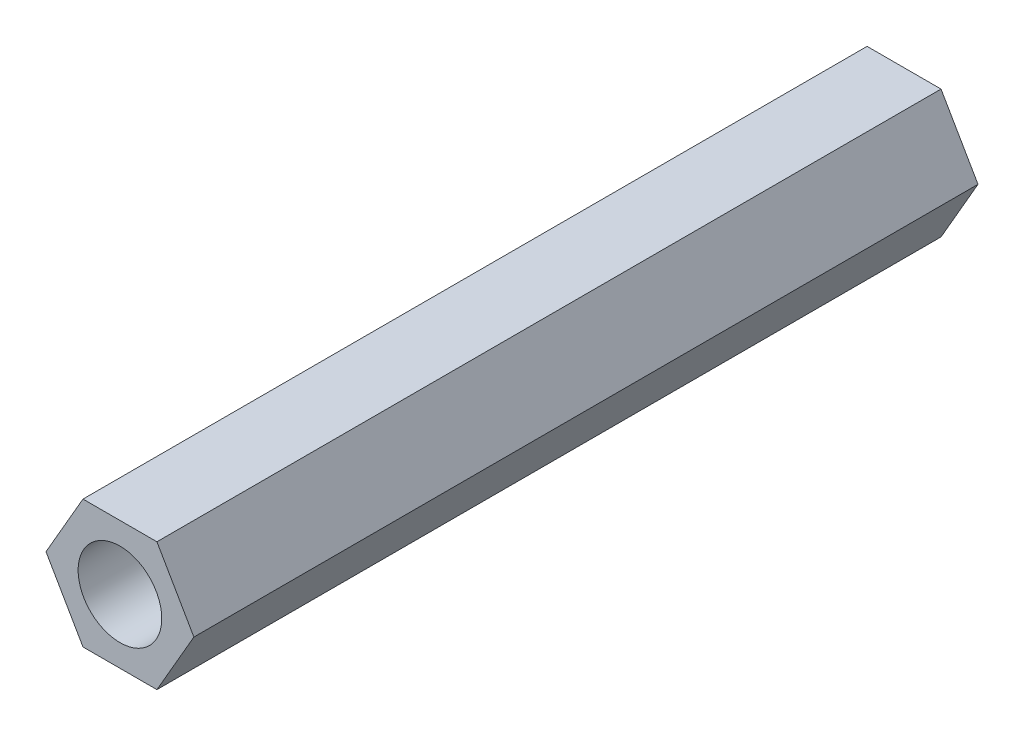
from build123d import *

# Parameters (mm, degrees)
SKETCH_1_R      = 1.6
EXTRUDE_1_DEPTH = 30


with BuildPart() as part:
    # 草图1 → 凸台-拉伸1 (new body)
    with BuildSketch(Plane.XY):
        Polygon((2.829016319, 0), (1.41450816, 2.45), (-1.41450816, 2.45), (-2.829016319, 0), (-1.41450816, -2.45), (1.41450816, -2.45), align=None)
        Circle(SKETCH_1_R, mode=Mode.SUBTRACT)
    extrude(amount=EXTRUDE_1_DEPTH)


solid = part.part
